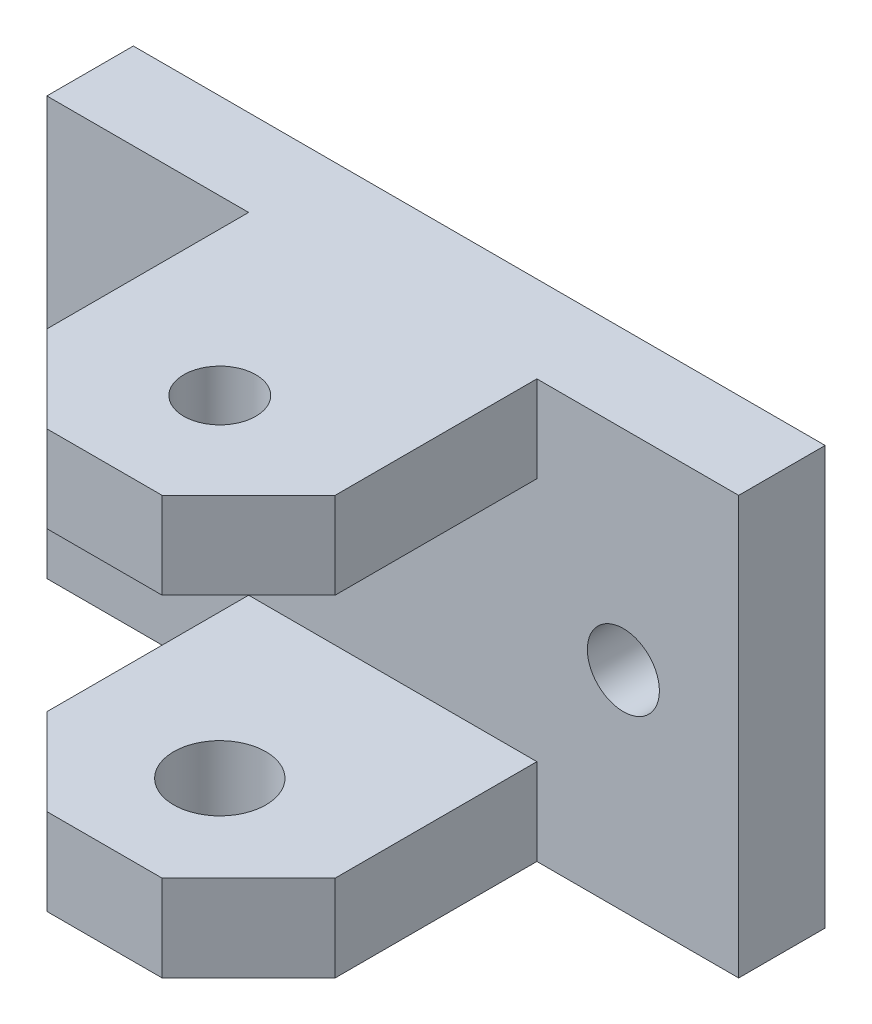
from build123d import *

# Parameters (mm, degrees)
SKETCH_1_W          = 24
SKETCH_1_H          = 14.5
EXTRUDE_1_DEPTH     = 3
SKETCH_2_W          = 10
SKETCH_2_H          = 14
EXTRUDE_1_2_DEPTH   = 3
CUT_EXTRUDE_1_REACH = 25.457
SKETCH_3_R          = 1.6
HOLE_WIZARD_M3_2_D  = 2.5
HOLE_WIZARD_M3_1_D  = 2.5
SKETCH_10_W         = 0.5
SKETCH_10_H         = 14.5
CUT_EXTRUDE_2_DEPTH = 20.813190051
SKETCH_11_W         = 10
SKETCH_11_H         = 1
CUT_EXTRUDE_3_DEPTH = 24.205602772
CHAMFER_1_SIZE      = 3
SKETCH_12_W         = 0.5
SKETCH_12_H         = 14.5
EXTRUDE_2_DEPTH     = 3


with BuildPart() as part:
    # 草图1 → Extrude 1 (new body)
    with BuildSketch(Plane.XY):
        Rectangle(SKETCH_1_W, SKETCH_1_H)
    extrude(amount=EXTRUDE_1_DEPTH)

    # 草图2 → Extrude 1 2 (add)
    with BuildSketch(Plane.XZ.offset(7.25)):
        with Locations((0, 7)):
            Rectangle(SKETCH_2_W, SKETCH_2_H)
    extrude_1_2 = extrude(amount=-EXTRUDE_1_2_DEPTH)

    # 镜向1: Extrude 1 2 across plane
    add(extrude_1_2.mirror(Plane.ZX))

    # 草图3 → 切除-拉伸1 (cut, up to next)
    with BuildSketch(Plane.XZ.offset(7.25), mode=Mode.PRIVATE) as cut_extrude_1_sk1:
        with Locations(Location((0, 9, 0), (0, 0, 270))):
            Circle(SKETCH_3_R)
    cut_extrude_1_tool1 = extrude(cut_extrude_1_sk1.sketch, amount=-CUT_EXTRUDE_1_REACH, mode=Mode.PRIVATE) & part.part
    add(cut_extrude_1_tool1.solids().sort_by_distance((0, -7.25, 9))[0], mode=Mode.SUBTRACT)

    # M3 螺纹孔2 (through all)
    with Locations(Plane(origin=(0, 7.25, 9), x_dir=(0, 0, 1), z_dir=(0, 1, 0))):
        with Locations((0, 0)):
            Hole(HOLE_WIZARD_M3_2_D / 2)

    # M3 螺纹孔1 (through all)
    with Locations(Plane.XY.offset(3)):
        with Locations((-8, 0), (8, 0)):
            Hole(HOLE_WIZARD_M3_1_D / 2)

    # 草图10 → 切除-拉伸2 (cut, through all)
    with BuildSketch(Plane(origin=(0, 0, 0), x_dir=(-1, 0, 0), z_dir=(0, 0, -1))):
        with Locations((-11.75, 0)):
            Rectangle(SKETCH_10_W, SKETCH_10_H)
        with Locations((11.75, 0)):
            Rectangle(SKETCH_10_W, SKETCH_10_H)
    extrude(amount=-CUT_EXTRUDE_2_DEPTH, mode=Mode.SUBTRACT)

    # 草图11 → 切除-拉伸3 (cut, through all)
    with BuildSketch(Plane.XZ.offset(7.25)):
        with Locations((0, 13.5)):
            Rectangle(SKETCH_11_W, SKETCH_11_H)
    extrude(amount=-CUT_EXTRUDE_3_DEPTH, mode=Mode.SUBTRACT)

    # 倒角1
    chamfer_1_edges = [part.edges().sort_by_distance(p)[0] for p in [
        (5, -5.75, 13),
        (-5, -5.75, 13),
        (-5, 5.75, 13),
        (5, 5.75, 13),
    ]]
    chamfer(chamfer_1_edges, length=CHAMFER_1_SIZE)

    # 草图12 → 凸台-拉伸2 (add)
    with BuildSketch(Plane.XY.offset(3)):
        with Locations((11.75, 0)):
            Rectangle(SKETCH_12_W, SKETCH_12_H)
    extrude_2 = extrude(amount=-EXTRUDE_2_DEPTH)

    # 镜向2: 凸台-拉伸2 across plane
    add(extrude_2.mirror(Plane(origin=(0, 0, 0), x_dir=(0, 0, 1), z_dir=(1, 0, 0))))


solid = part.part
